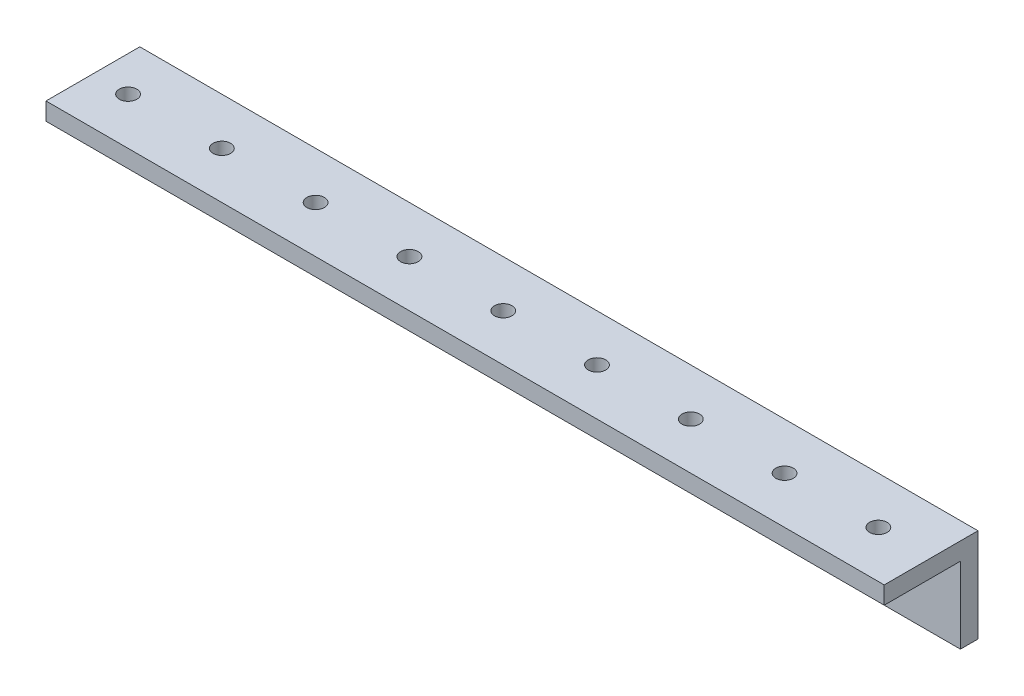
from build123d import *

# Parameters (mm, degrees)
ESQUISSE1_W                = 143
ESQUISSE1_H                = 16
BOSS_EXTRU_1_DEPTH         = 3
ESQUISSE2_W                = 143
ESQUISSE2_H                = 3
BOSS_EXTRU_2_DEPTH         = 13
ESQUISSE4_R                = 1.5
ENL_V_MAT_EXTRU_1_DEPTH    = 10
R_P_TITION_LIN_AIRE1_COUNT = 9
R_P_TITION_LIN_AIRE1_PITCH = 16
ESQUISSE5_R                = 1.5
ENL_V_MAT_EXTRU_2_DEPTH    = 10
R_P_TITION_LIN_AIRE2_COUNT = 9
R_P_TITION_LIN_AIRE2_PITCH = 16


with BuildPart() as part:
    # Esquisse1 → Boss.-Extru.1 (new body)
    with BuildSketch(Plane.XY):
        with Locations((71.5, 8)):
            Rectangle(ESQUISSE1_W, ESQUISSE1_H)
    extrude(amount=BOSS_EXTRU_1_DEPTH)

    # Esquisse2 → Boss.-Extru.2 (add)
    with BuildSketch(Plane.XY.offset(3)):
        with Locations((71.5, 14.5)):
            Rectangle(ESQUISSE2_W, ESQUISSE2_H)
    extrude(amount=BOSS_EXTRU_2_DEPTH)

    # Esquisse4 → Enlèv. mat.-Extru.1 (cut)
    with BuildSketch(Plane(origin=(0, 0, 0), x_dir=(-1, 0, 0), z_dir=(0, 0, -1))):
        with Locations((-134, 8)):
            Circle(ESQUISSE4_R)
    enl_v_mat_extru_1 = extrude(amount=-ENL_V_MAT_EXTRU_1_DEPTH, mode=Mode.SUBTRACT)

    # Répétition linéaire1: Enlèv. mat.-Extru.1 ×9
    with Locations(*[(-i * R_P_TITION_LIN_AIRE1_PITCH, 0, 0) for i in range(1, R_P_TITION_LIN_AIRE1_COUNT)]):
        add(enl_v_mat_extru_1, mode=Mode.SUBTRACT)

    # Esquisse5 → Enlèv. mat.-Extru.2 (cut)
    with BuildSketch(Plane(origin=(0, 16, 0), x_dir=(1, 0, 0), z_dir=(0, 1, 0))):
        with Locations(Location((134, -8, 0), (0, 0, 270))):
            Circle(ESQUISSE5_R)
    enl_v_mat_extru_2 = extrude(amount=-ENL_V_MAT_EXTRU_2_DEPTH, mode=Mode.SUBTRACT)

    # Répétition linéaire2: Enlèv. mat.-Extru.2 ×9
    with Locations(*[(-i * R_P_TITION_LIN_AIRE2_PITCH, 0, 0) for i in range(1, R_P_TITION_LIN_AIRE2_COUNT)]):
        add(enl_v_mat_extru_2, mode=Mode.SUBTRACT)


solid = part.part
